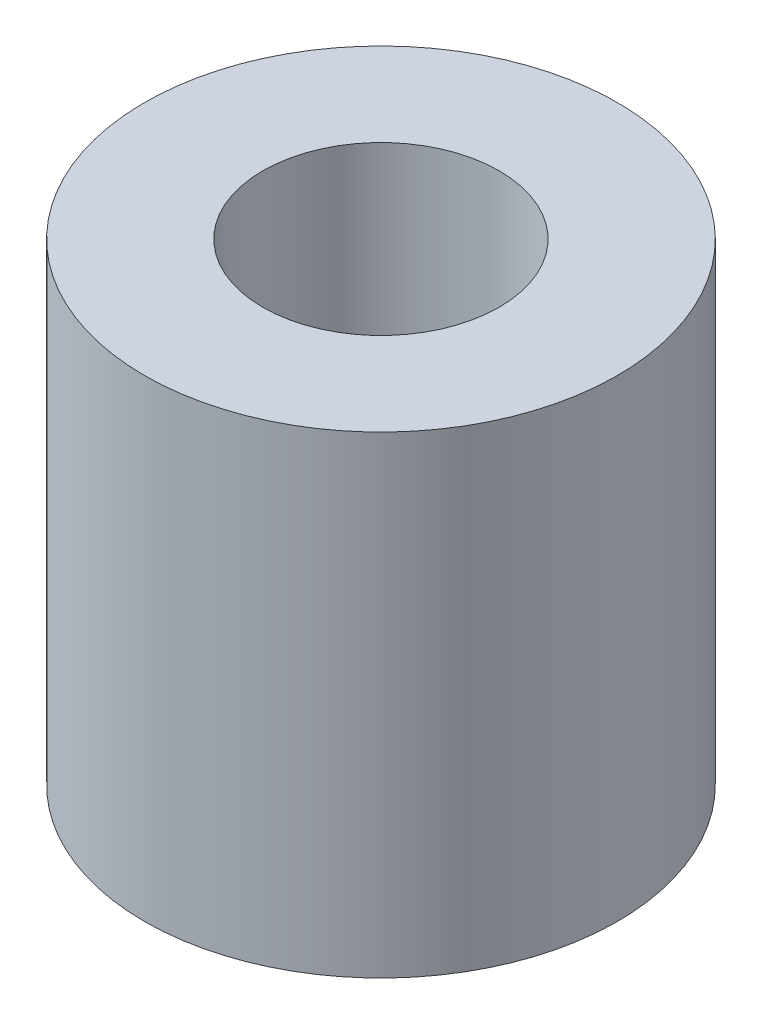
from build123d import *

# Parameters (mm, degrees)
SKETCH1_R           = 2.54
SKETCH1_R_2         = 1.27
BOSS_EXTRUDE1_DEPTH = 5.08


with BuildPart() as part:
    # Sketch1 → Boss-Extrude1 (new body)
    with BuildSketch(Plane(origin=(0, 0, 0), x_dir=(1, 0, 0), z_dir=(0, 1, 0))):
        with Locations(Location((0, 0, 0), (0, 0, 270))):
            Circle(SKETCH1_R)
        with Locations(Location((0, 0, 0), (0, 0, 270))):
            Circle(SKETCH1_R_2, mode=Mode.SUBTRACT)
    extrude(amount=BOSS_EXTRUDE1_DEPTH)


solid = part.part
